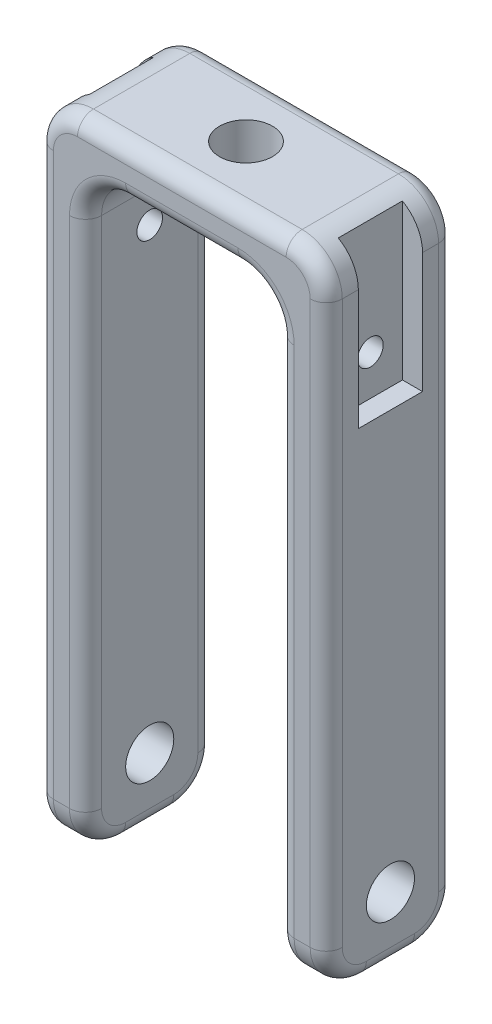
from build123d import *

# Parameters (mm, degrees)
SKETCH_1_W          = 36
SKETCH_1_H          = 16
EXTRUDE_1_DEPTH     = 80
SKETCH_3_W          = 24
SKETCH_3_H          = 74
CUT_EXTRUDE_1_DEPTH = 84.546394297
FILLET_1_R          = 5
FILLET_2_R          = 2
SKETCH_4_R          = 3
CUT_EXTRUDE_2_DEPTH = 89.090862182
SKETCH_2_R          = 3.3
CUT_EXTRUDE_3_DEPTH = 83.389319696
SKETCH_5_W          = 2.5
SKETCH_5_H          = 8
CUT_EXTRUDE_4_DEPTH = 20
SKETCH_6_R          = 1.6
CUT_EXTRUDE_5_DEPTH = 88.099081511


with BuildPart() as part:
    # 草图1 → 凸台-拉伸1 (new body)
    with BuildSketch(Plane(origin=(0, 0, 0), x_dir=(1, 0, 0), z_dir=(0, 1, 0))):
        Rectangle(SKETCH_1_W, SKETCH_1_H)
    extrude(amount=-EXTRUDE_1_DEPTH)

    # 草图3 → 切除-拉伸1 (cut, through all)
    with BuildSketch(Plane.XY.offset(8)):
        with Locations((0, -43)):
            Rectangle(SKETCH_3_W, SKETCH_3_H)
    extrude(amount=-CUT_EXTRUDE_1_DEPTH, mode=Mode.SUBTRACT)

    # 圆角1
    fillet_1_edges = [part.edges().sort_by_distance(p)[0] for p in [
        (15, -80, -8),
        (-15, -80, -8),
        (15, -80, 8),
        (-12, -6, 0),
        (12, -6, 0),
        (18, 0, 0),
        (-18, 0, 0),
        (-15, -80, 8),
    ]]
    fillet(fillet_1_edges, radius=FILLET_1_R)

    # 圆角2
    fillet_2_edges = [part.edges().sort_by_distance(p)[0] for p in [
        (-12, -43, -8),
        (-18, -40, -8),
        (0, 0, -8),
        (18, -40, -8),
        (12, -43, -8),
        (0, -6, -8),
        (16.535533906, -1.464466094, -8),
        (-16.535533906, -1.464466094, -8),
        (-18, -80, 0),
        (-18, -40, 8),
        (-18, -78.535533906, 6.535533906),
        (-18, -78.535533906, -6.535533906),
        (-12, -80, 0),
        (-12, -43, 8),
        (-12, -78.535533906, 6.535533906),
        (-12, -78.535533906, -6.535533906),
        (12, -43, 8),
        (12, -80, 0),
        (12, -78.535533906, 6.535533906),
        (12, -78.535533906, -6.535533906),
        (18, -80, 0),
        (18, -40, 8),
        (18, -78.535533906, 6.535533906),
        (18, -78.535533906, -6.535533906),
        (0, -6, 8),
        (0, 0, 8),
        (16.535533906, -1.464466094, 8),
        (-16.535533906, -1.464466094, 8),
        (10.535533906, -7.464466094, 8),
        (10.535533906, -7.464466094, -8),
        (-10.535533906, -7.464466094, 8),
        (-10.535533906, -7.464466094, -8),
    ]]
    fillet(fillet_2_edges, radius=FILLET_2_R)

    # 草图4 → 切除-拉伸2 (cut, through all)
    with BuildSketch(Plane(origin=(18, 0, 0), x_dir=(0, 0, -1), z_dir=(1, 0, 0))):
        with Locations((0, -72)):
            Circle(SKETCH_4_R)
    extrude(amount=-CUT_EXTRUDE_2_DEPTH, mode=Mode.SUBTRACT)

    # 草图2 → 切除-拉伸3 (cut, through all)
    with BuildSketch(Plane(origin=(0, 0, 0), x_dir=(1, 0, 0), z_dir=(0, 1, 0))):
        with Locations(Location((0, 0, 0), (0, 0, 270))):
            Circle(SKETCH_2_R)
    extrude(amount=-CUT_EXTRUDE_3_DEPTH, mode=Mode.SUBTRACT)

    # 草图5 → 切除-拉伸4 (cut)
    with BuildSketch(Plane(origin=(0, 0, 0), x_dir=(1, 0, 0), z_dir=(0, 1, 0))):
        with Locations((-16.75, 0)):
            Rectangle(SKETCH_5_W, SKETCH_5_H)
        with Locations((16.75, 0)):
            Rectangle(SKETCH_5_W, SKETCH_5_H)
    extrude(amount=-CUT_EXTRUDE_4_DEPTH, mode=Mode.SUBTRACT)

    # 草图6 → 切除-拉伸5 (cut, through all)
    with BuildSketch(Plane.ZY.offset(15.5)):
        with Locations((0, -15)):
            Circle(SKETCH_6_R)
    extrude(amount=-CUT_EXTRUDE_5_DEPTH, mode=Mode.SUBTRACT)


solid = part.part
